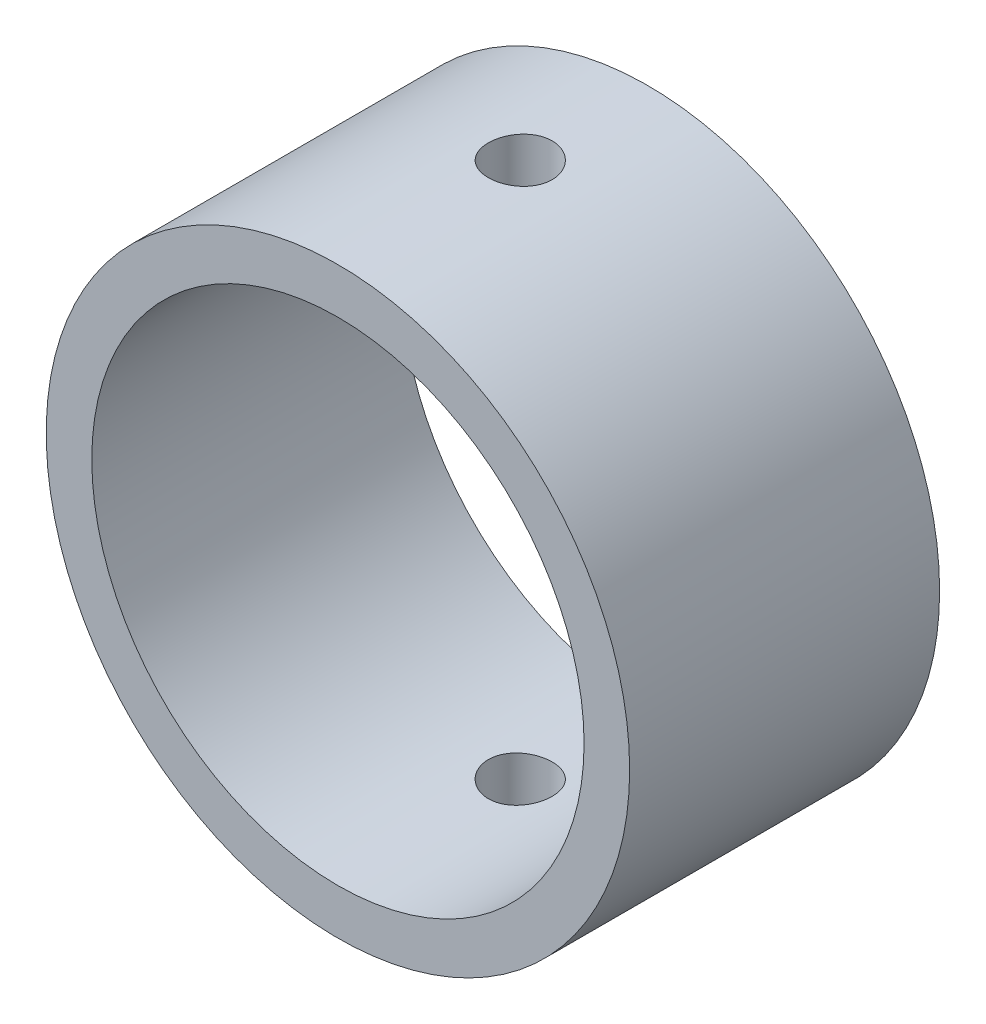
from build123d import *

# Parameters (mm, degrees)
SKETCH1_R           = 16
SKETCH1_R_2         = 13.5
BOSS_EXTRUDE1_DEPTH = 17
SKETCH2_R           = 1.75
CUT_EXTRUDE1_DEPTH  = 35


with BuildPart() as part:
    # Sketch1 → Boss-Extrude1 (new body)
    with BuildSketch(Plane.XY):
        Circle(SKETCH1_R)
        Circle(SKETCH1_R_2, mode=Mode.SUBTRACT)
    extrude(amount=BOSS_EXTRUDE1_DEPTH)

    # Sketch2 → Cut-Extrude1 (cut)
    with BuildSketch(Plane(origin=(0, 16, 0), x_dir=(1, 0, 0), z_dir=(0, 1, 0))):
        with Locations(Location((0, -7, 0), (0, 0, 270))):
            Circle(SKETCH2_R)
    extrude(amount=-CUT_EXTRUDE1_DEPTH, mode=Mode.SUBTRACT)


solid = part.part
